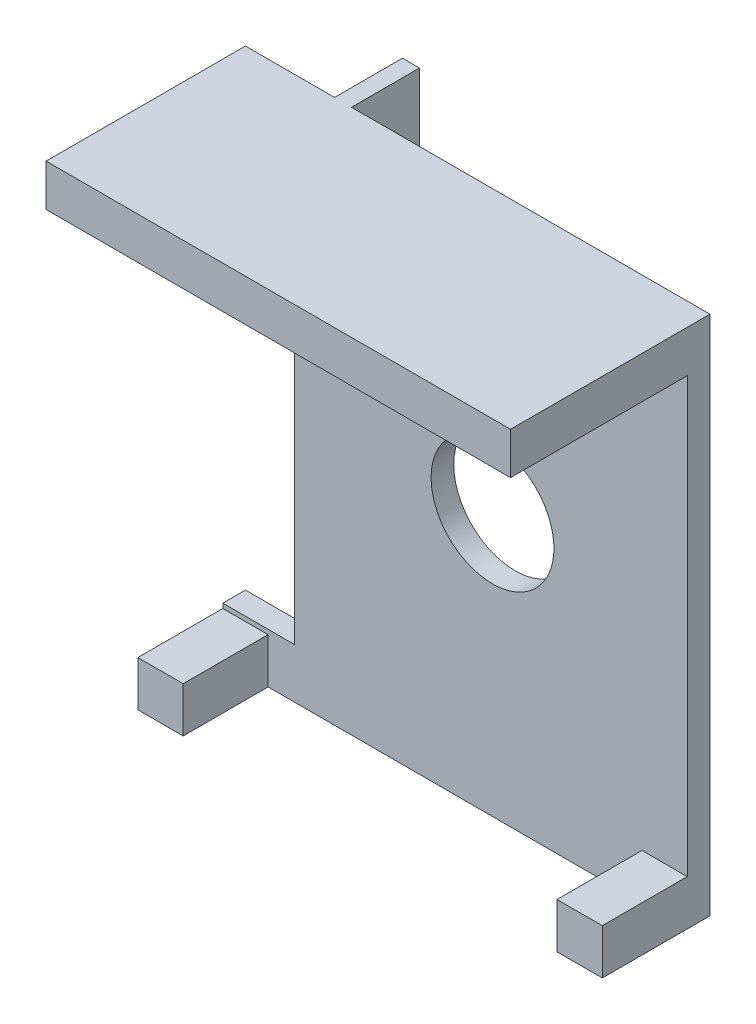
from build123d import *

# Parameters (mm, degrees)
SCHIZZO1_W                   = 41
SCHIZZO1_H                   = 46
ESTRUSIONE_ESTRUSIONE1_DEPTH = 2
SCHIZZO2_W                   = 4
SCHIZZO2_H                   = 4
ESTRUSIONE_ESTRUSIONE2_DEPTH = 7.5
SCHIZZO3_W                   = 41
SCHIZZO3_H                   = 3.7
ESTRUSIONE_ESTRUSIONE3_DEPTH = 15.6
SCHIZZO4_W                   = 6.315683346
SCHIZZO4_H                   = 34.34145986
TAGLIO_ESTRUSIONE1_DEPTH     = 2
SCHIZZO5_W                   = 1.5
SCHIZZO5_H                   = 14
ESTRUSIONE_ESTRUSIONE4_DEPTH = 6
SCHIZZO7_R                   = 5.421973109
TAGLIO_ESTRUSIONE3_DEPTH     = 2


with BuildPart() as part:
    # Schizzo1 → Estrusione-Estrusione1 (new body)
    with BuildSketch(Plane.XY):
        with Locations((20.5, 23)):
            Rectangle(SCHIZZO1_W, SCHIZZO1_H)
    extrude(amount=ESTRUSIONE_ESTRUSIONE1_DEPTH)

    # Schizzo2 → Estrusione-Estrusione2 (add)
    with BuildSketch(Plane.XY.offset(2)):
        with Locations((2, 2)):
            Rectangle(SCHIZZO2_W, SCHIZZO2_H)
        with Locations((39, 2)):
            Rectangle(SCHIZZO2_W, SCHIZZO2_H)
    extrude(amount=ESTRUSIONE_ESTRUSIONE2_DEPTH)

    # Schizzo3 → Estrusione-Estrusione3 (add)
    with BuildSketch(Plane.XY.offset(2)):
        with Locations((20.5, 44.15)):
            Rectangle(SCHIZZO3_W, SCHIZZO3_H)
    extrude(amount=ESTRUSIONE_ESTRUSIONE3_DEPTH)

    # Schizzo4 → Taglio-Estrusione1 (cut)
    with BuildSketch(Plane(origin=(0, 0, 0), x_dir=(-1, 0, 0), z_dir=(0, 0, -1))):
        with Locations((-3.157841673, 21.578763697)):
            Rectangle(SCHIZZO4_W, SCHIZZO4_H)
    extrude(amount=-TAGLIO_ESTRUSIONE1_DEPTH, mode=Mode.SUBTRACT)

    # Schizzo5 → Estrusione-Estrusione4 (add)
    with BuildSketch(Plane(origin=(0, 0, 0), x_dir=(-1, 0, 0), z_dir=(0, 0, -1))):
        with Locations((-8.611501058, 39)):
            Rectangle(SCHIZZO5_W, SCHIZZO5_H)
    extrude(amount=ESTRUSIONE_ESTRUSIONE4_DEPTH)

    # Schizzo7 → Taglio-Estrusione3 (cut)
    with BuildSketch(Plane(origin=(0, 0, 0), x_dir=(-1, 0, 0), z_dir=(0, 0, -1))):
        with Locations((-23.8073986, 23.20549075)):
            Circle(SCHIZZO7_R)
    extrude(amount=-TAGLIO_ESTRUSIONE3_DEPTH, mode=Mode.SUBTRACT)


solid = part.part
